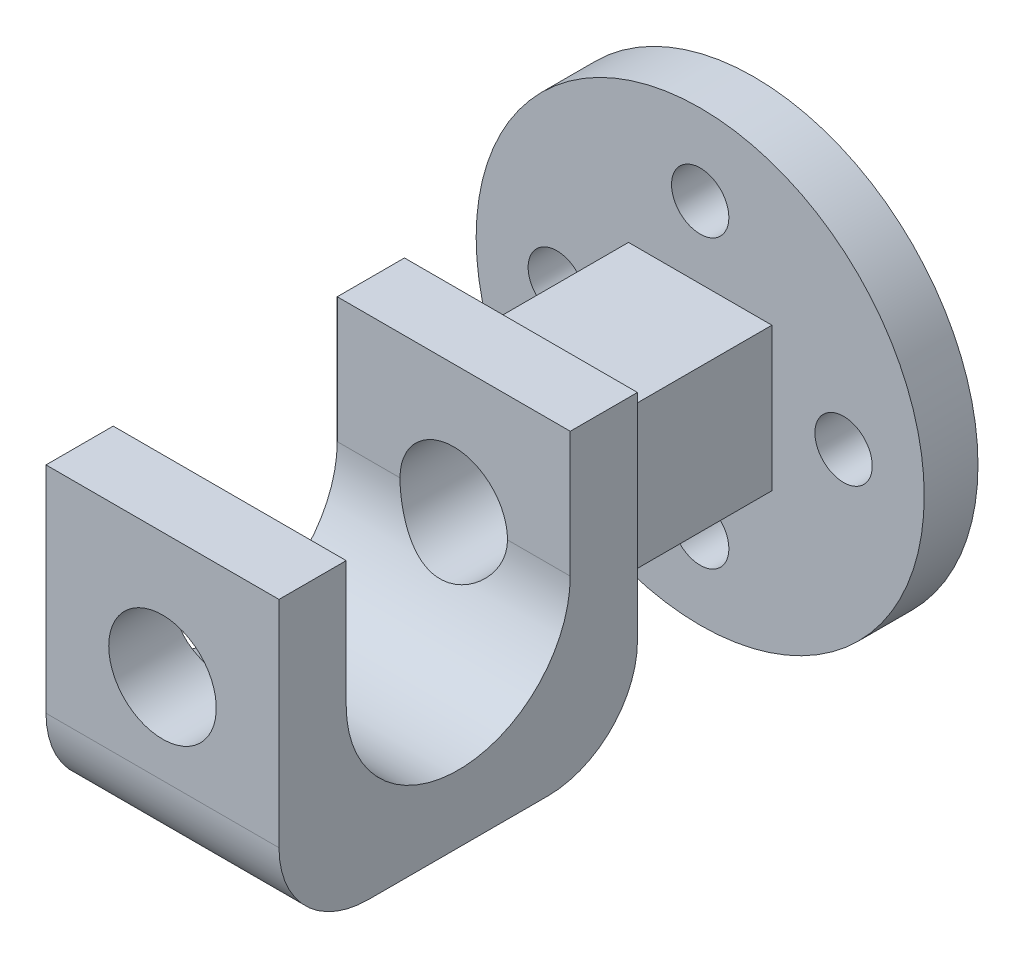
from build123d import *

# Parameters (mm, degrees)
SKETCH_1_R          = 12.5
SKETCH_1_R_2        = 1.6
EXTRUDE_1_DEPTH     = 3
SKETCH_2_W          = 8
SKETCH_2_H          = 8
EXTRUDE_2_DEPTH     = 10
EXTRUDE_3_DEPTH     = 6.5
SKETCH_5_R          = 3
CUT_EXTRUDE_1_DEPTH = 38.436613095
FILLET_1_R          = 5


with BuildPart() as part:
    # 草图1 → 凸台-拉伸1 (new body)
    with BuildSketch(Plane.XY):
        Circle(SKETCH_1_R)
        with Locations((0, 8)):
            Circle(SKETCH_1_R_2, mode=Mode.SUBTRACT)
        with Locations((8, 0)):
            Circle(SKETCH_1_R_2, mode=Mode.SUBTRACT)
        with Locations((0, -8)):
            Circle(SKETCH_1_R_2, mode=Mode.SUBTRACT)
        with Locations((-8, 0)):
            Circle(SKETCH_1_R_2, mode=Mode.SUBTRACT)
    extrude(amount=EXTRUDE_1_DEPTH)

    # 草图2 → 凸台-拉伸2 (add)
    with BuildSketch(Plane.XY.offset(3)):
        Rectangle(SKETCH_2_W, SKETCH_2_H)
    extrude(amount=EXTRUDE_2_DEPTH)

    # 草图4 → 凸台-拉伸3 (add, symmetric)
    with BuildSketch(Plane.ZY):
        with BuildLine():
            Line((13, -10), (33, -10))
            Line((33, -10), (33, 7))
            Line((33, 7), (29.25, 7))
            Line((29.25, 7), (29.25, 0))
            ThreePointArc((29.25, 0), (23, -6.25), (16.75, 0))
            Line((16.75, 0), (16.75, 7))
            Line((16.75, 7), (13, 7))
            Line((13, 7), (13, -10))
        make_face()
    extrude(amount=EXTRUDE_3_DEPTH, both=True)

    # 草图5 → 切除-拉伸1 (cut, through all)
    with BuildSketch(Plane(origin=(0, 0, 0), x_dir=(-1, 0, 0), z_dir=(0, 0, -1))):
        Circle(SKETCH_5_R)
    extrude(amount=-CUT_EXTRUDE_1_DEPTH, mode=Mode.SUBTRACT)

    # 圆角1
    fillet_1_edges = [part.edges().sort_by_distance(p)[0] for p in [
        (0, -10, 13),
        (0, -10, 33),
    ]]
    fillet(fillet_1_edges, radius=FILLET_1_R)


solid = part.part
